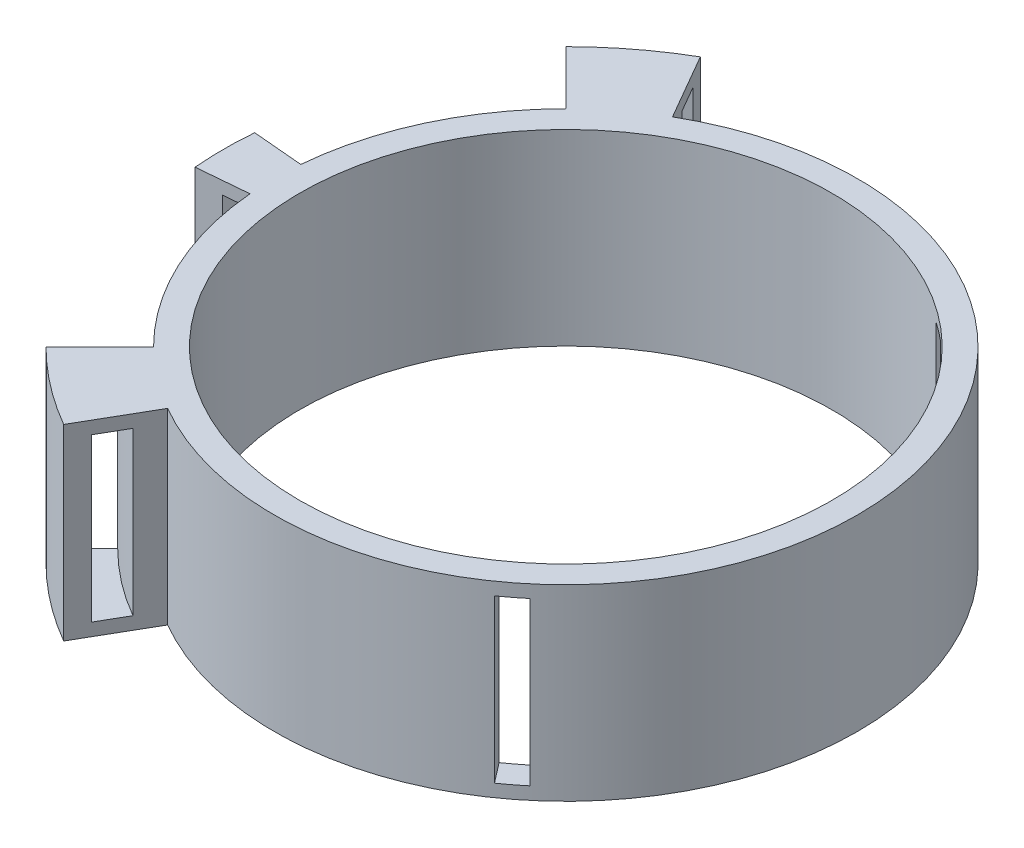
from build123d import *
from build123d.topology import SkipClean

# Parameters (mm, degrees)
EXTRUDE_1_DEPTH = 0.5
EXTRUDE_2_DEPTH = 6.4
EXTRUDE_3_DEPTH = 0.5
EXTRUDE_4_DEPTH = 6.4
EXTRUDE_5_DEPTH = 0.5
EXTRUDE_START   = -7.4
EXTRUDE_6_DEPTH = 7.4


with BuildPart() as part:
    # 草图1 → 凸台-拉伸1 (new body)
    with BuildSketch(Plane(origin=(0, 0, 0), x_dir=(1, 0, 0), z_dir=(0, 1, 0))):
        with BuildLine():
            Line((11.456239028, 1.002291042), (10.46004433, 0.915135299))
            ThreePointArc((10.46004433, 0.915135299), (-10.5, 0), (10.46004433, -0.915135299))
            Line((10.46004433, -0.915135299), (11.456239028, -1.002291042))
            ThreePointArc((11.456239028, -1.002291042), (5.310109052, -10.200624582), (-5.75, -9.959292144))
            Line((-5.75, -9.959292144), (-7.25, -12.557368355))
            ThreePointArc((-7.25, -12.557368355), (-8.827040721, -11.503623434), (-10.253048327, -10.253048327))
            Line((-10.253048327, -10.253048327), (-8.131727984, -8.131727984))
            ThreePointArc((-8.131727984, -8.131727984), (-10.422539551, -4.86011001), (-11.456239028, -1.002291042))
            Line((-11.456239028, -1.002291042), (-13.448628424, -1.176602527))
            ThreePointArc((-13.448628424, -1.176602527), (-13.5, 0), (-13.448628424, 1.176602527))
            Line((-13.448628424, 1.176602527), (-11.456239028, 1.002291042))
            ThreePointArc((-11.456239028, 1.002291042), (-10.422539551, 4.86011001), (-8.131727984, 8.131727984))
            Line((-8.131727984, 8.131727984), (-10.253048327, 10.253048327))
            ThreePointArc((-10.253048327, 10.253048327), (-8.827040721, 11.503623434), (-7.25, 12.557368355))
            Line((-7.25, 12.557368355), (-5.75, 9.959292144))
            ThreePointArc((-5.75, 9.959292144), (5.310109052, 10.200624582), (11.456239028, 1.002291042))
        make_face()
    extrude(amount=EXTRUDE_1_DEPTH)

    # 草图10 → 凸台-拉伸2 (add)
    with BuildSketch(Plane(origin=(0, 0.5, 0), x_dir=(1, 0, 0), z_dir=(0, 1, 0))):
        with BuildLine():
            Line((10.46004433, -0.915135299), (11.456239028, -1.002291042))
            ThreePointArc((11.456239028, -1.002291042), (10.200624582, -5.310109052), (7.392057511, -8.809511096))
            Line((7.392057511, -8.809511096), (6.749269902, -8.043466653))
            ThreePointArc((6.749269902, -8.043466653), (9.313613748, -4.848360439), (10.46004433, -0.915135299))
        make_face()
        with BuildLine():
            Line((10.46004433, 0.915135299), (11.456239028, 1.002291042))
            ThreePointArc((11.456239028, 1.002291042), (10.187396942, 5.335442206), (7.348181349, 8.846142146))
            Line((7.348181349, 8.846142146), (6.709209057, 8.076912394))
            ThreePointArc((6.709209057, 8.076912394), (9.301536339, 4.87149071), (10.46004433, 0.915135299))
        make_face()
        with BuildLine():
            Line((6.601509895, -9.416478488), (5.991894646, -8.622482157))
            ThreePointArc((5.991894646, -8.622482157), (-10.499966218, -0.026634823), (5.94807324, 8.652769772))
            Line((5.94807324, 8.652769772), (6.553696854, 9.449817858))
            ThreePointArc((6.553696854, 9.449817858), (-11.49996307, -0.02914447), (6.601509895, -9.416478488))
        make_face()
    extrude(amount=EXTRUDE_2_DEPTH)

    # 草图11 → 凸台-拉伸3 (add)
    with BuildSketch(Plane(origin=(0, 6.9, 0), x_dir=(1, 0, 0), z_dir=(0, 1, 0))):
        with BuildLine():
            Line((10.46004433, 0.915135299), (11.456239028, 1.002291042))
            ThreePointArc((11.456239028, 1.002291042), (-11.5, 0), (11.456239028, -1.002291042))
            Line((11.456239028, -1.002291042), (10.46004433, -0.915135299))
            ThreePointArc((10.46004433, -0.915135299), (-10.5, 0), (10.46004433, 0.915135299))
        make_face()
    extrude(amount=EXTRUDE_3_DEPTH)

    # 草图12 → 凸台-拉伸4 (add)
    with BuildSketch(Plane(origin=(0, 0.5, 0), x_dir=(1, 0, 0), z_dir=(0, 1, 0))):
        with BuildLine():
            Line((-8.131727984, -8.131727984), (-8.838834765, -8.838834765))
            ThreePointArc((-8.838834765, -8.838834765), (-7.609517863, -9.916916754), (-6.25, -10.825317547))
            Line((-6.25, -10.825317547), (-5.75, -9.959292144))
            ThreePointArc((-5.75, -9.959292144), (-7.000756434, -9.123563413), (-8.131727984, -8.131727984))
        make_face()
        with BuildLine():
            Line((-10.253048327, -10.253048327), (-9.687362902, -9.687362902))
            ThreePointArc((-9.687362902, -9.687362902), (-8.340031577, -10.868940762), (-6.85, -11.864548032))
            Line((-6.85, -11.864548032), (-7.25, -12.557368355))
            ThreePointArc((-7.25, -12.557368355), (-8.827040721, -11.503623434), (-10.253048327, -10.253048327))
        make_face()
        with BuildLine():
            Line((-10.253048327, 10.253048327), (-9.687362902, 9.687362902))
            ThreePointArc((-9.687362902, 9.687362902), (-8.340031577, 10.868940762), (-6.85, 11.864548032))
            Line((-6.85, 11.864548032), (-7.25, 12.557368355))
            ThreePointArc((-7.25, 12.557368355), (-8.827040721, 11.503623434), (-10.253048327, 10.253048327))
        make_face()
        with BuildLine():
            Line((-5.75, 9.959292144), (-6.25, 10.825317547))
            ThreePointArc((-6.25, 10.825317547), (-7.609517863, 9.916916754), (-8.838834765, 8.838834765))
            Line((-8.838834765, 8.838834765), (-8.131727984, 8.131727984))
            ThreePointArc((-8.131727984, 8.131727984), (-7.000756434, 9.123563413), (-5.75, 9.959292144))
        make_face()
        with BuildLine():
            Line((-13.448628424, 1.176602527), (-12.452433726, 1.089446784))
            ThreePointArc((-12.452433726, 1.089446784), (-12.5, 0), (-12.452433726, -1.089446784))
            Line((-12.452433726, -1.089446784), (-13.448628424, -1.176602527))
            ThreePointArc((-13.448628424, -1.176602527), (-13.5, 0), (-13.448628424, 1.176602527))
        make_face()
    extrude(amount=EXTRUDE_4_DEPTH)

    # 草图13 → 凸台-拉伸5 (add)
    with BuildSketch(Plane(origin=(0, 6.9, 0), x_dir=(1, 0, 0), z_dir=(0, 1, 0))):
        with BuildLine():
            Line((-8.131727984, -8.131727984), (-10.253048327, -10.253048327))
            ThreePointArc((-10.253048327, -10.253048327), (-8.827040721, -11.503623434), (-7.25, -12.557368355))
            Line((-7.25, -12.557368355), (-5.75, -9.959292144))
            ThreePointArc((-5.75, -9.959292144), (-7.000756434, -9.123563413), (-8.131727984, -8.131727984))
        make_face()
        with BuildLine():
            Line((-7.25, 12.557368355), (-5.75, 9.959292144))
            ThreePointArc((-5.75, 9.959292144), (-7.000756434, 9.123563413), (-8.131727984, 8.131727984))
            Line((-8.131727984, 8.131727984), (-10.253048327, 10.253048327))
            ThreePointArc((-10.253048327, 10.253048327), (-8.827040721, 11.503623434), (-7.25, 12.557368355))
        make_face()
        with BuildLine():
            Line((-13.448628424, 1.176602527), (-11.456239028, 1.002291042))
            ThreePointArc((-11.456239028, 1.002291042), (-11.5, 0), (-11.456239028, -1.002291042))
            Line((-11.456239028, -1.002291042), (-13.448628424, -1.176602527))
            ThreePointArc((-13.448628424, -1.176602527), (-13.5, 0), (-13.448628424, 1.176602527))
        make_face()
    extrude(amount=EXTRUDE_5_DEPTH)

    # 草图14 → 凸台-拉伸6 (add)
    with SkipClean():  # the faces are left unmerged after this step: merging them gives an invalid solid
        with BuildSketch(Plane(origin=(0, 7.4, 0), x_dir=(1, 0, 0), z_dir=(0, 1, 0)).offset(EXTRUDE_START)):
            with BuildLine():
                Line((10.46004433, 0.915135299), (11.456239028, 1.002291042))
                ThreePointArc((11.456239028, 1.002291042), (11.5, 0), (11.456239028, -1.002291042))
                Line((11.456239028, -1.002291042), (10.46004433, -0.915135299))
                ThreePointArc((10.46004433, -0.915135299), (10.5, 0), (10.46004433, 0.915135299))
            make_face()
        extrude(amount=EXTRUDE_6_DEPTH)


solid = part.part
